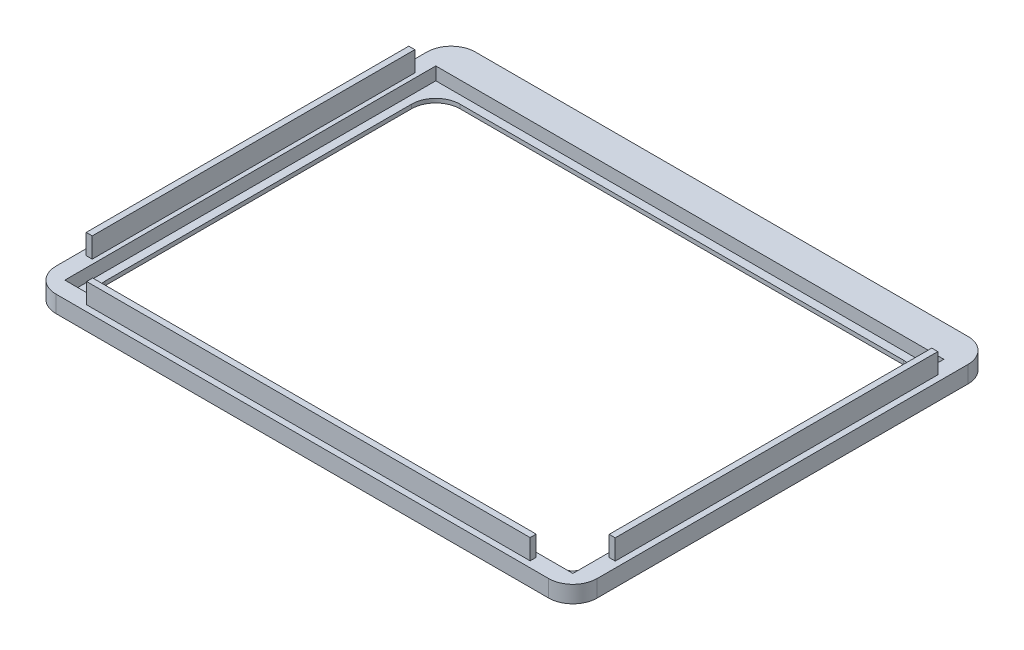
from build123d import *

# Parameters (mm, degrees)
BOSS_EXTRUDE1_DEPTH = 2.1
SKETCH3_W           = 63
SKETCH3_H           = 46
CUT_EXTRUDE1_DEPTH  = 1.6
CUT_EXTRUDE2_DEPTH  = 0.5
SKETCH6_W           = 0.75
SKETCH6_H           = 40
SKETCH6_W_2         = 55
SKETCH6_H_2         = 0.75
BOSS_EXTRUDE2_DEPTH = 2.5


with BuildPart() as part:
    # Sketch1 → Boss-Extrude1 (new body)
    with BuildSketch(Plane(origin=(0, 0, 0), x_dir=(1, 0, 0), z_dir=(0, 1, 0))):
        with BuildLine():
            Line((3, 0), (64.1, 0))
            ThreePointArc((64.1, 0), (66.221320344, 0.878679656), (67.1, 3))
            Line((67.1, 3), (67.1, 49))
            ThreePointArc((67.1, 49), (66.221320344, 51.121320344), (64.1, 52))
            Line((64.1, 52), (3, 52))
            ThreePointArc((3, 52), (0.878679656, 51.121320344), (0, 49))
            Line((0, 49), (0, 3))
            ThreePointArc((0, 3), (0.878679656, 0.878679656), (3, 0))
        make_face()
    extrude(amount=BOSS_EXTRUDE1_DEPTH)

    # Sketch3 → Cut-Extrude1 (cut)
    with BuildSketch(Plane(origin=(0, 2.1, 0), x_dir=(1, 0, 0), z_dir=(0, 1, 0))):
        with Locations((33.55, 25.05)):
            Rectangle(SKETCH3_W, SKETCH3_H)
    extrude(amount=-CUT_EXTRUDE1_DEPTH, mode=Mode.SUBTRACT)

    # Sketch5 → Cut-Extrude2 (cut)
    with BuildSketch(Plane(origin=(0, 0.5, 0), x_dir=(1, 0, 0), z_dir=(0, 1, 0))):
        with BuildLine():
            Line((6.05, 47.05), (61.05, 47.05))
            ThreePointArc((61.05, 47.05), (63.171320344, 46.171320344), (64.05, 44.05))
            Line((64.05, 44.05), (64.05, 6.05))
            ThreePointArc((64.05, 6.05), (63.171320344, 3.928679656), (61.05, 3.05))
            Line((61.05, 3.05), (6.05, 3.05))
            ThreePointArc((6.05, 3.05), (3.928679656, 3.928679656), (3.05, 6.05))
            Line((3.05, 6.05), (3.05, 44.05))
            ThreePointArc((3.05, 44.05), (3.928679656, 46.171320344), (6.05, 47.05))
        make_face()
    extrude(amount=-CUT_EXTRUDE2_DEPTH, mode=Mode.SUBTRACT)

    # Sketch6 → Boss-Extrude2 (add)
    with BuildSketch(Plane(origin=(0, 2.1, 0), x_dir=(1, 0, 0), z_dir=(0, 1, 0))):
        with Locations((65.975, 26)):
            Rectangle(SKETCH6_W, SKETCH6_H)
        with Locations((1.125, 26)):
            Rectangle(SKETCH6_W, SKETCH6_H)
        with Locations((33.55, 1.125)):
            Rectangle(SKETCH6_W_2, SKETCH6_H_2)
    extrude(amount=BOSS_EXTRUDE2_DEPTH)


solid = part.part
